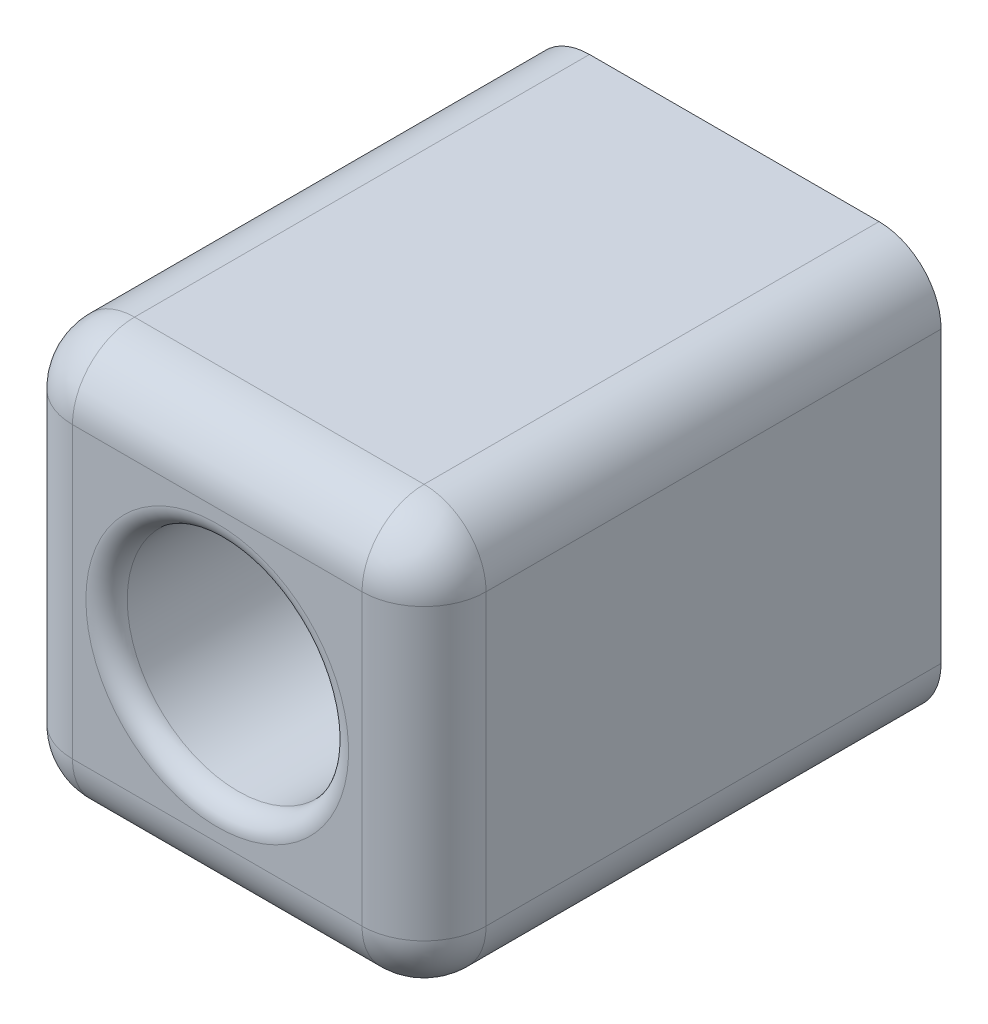
from build123d import *

# Parameters (mm, degrees)
SKETCH1_R           = 3.2
BOSS_EXTRUDE1_DEPTH = 25
FILLET1_R           = 3
SKETCH2_R           = 5.35
CUT_EXTRUDE1_DEPTH  = 19.5
FILLET2_R           = 1
FILLET3_R           = 1


with BuildPart() as part:
    # Sketch1 → Boss-Extrude1 (new body)
    with BuildSketch(Plane.XY):
        with BuildLine():
            Line((-7, -10), (7, -10))
            ThreePointArc((7, -10), (9.121320344, -9.121320344), (10, -7))
            Line((10, -7), (10, 7))
            ThreePointArc((10, 7), (9.121320344, 9.121320344), (7, 10))
            Line((7, 10), (-7, 10))
            ThreePointArc((-7, 10), (-9.121320344, 9.121320344), (-10, 7))
            Line((-10, 7), (-10, -7))
            ThreePointArc((-10, -7), (-9.121320344, -9.121320344), (-7, -10))
        make_face()
        Circle(SKETCH1_R, mode=Mode.SUBTRACT)
    extrude(amount=BOSS_EXTRUDE1_DEPTH)

    # Fillet1
    fillet1_edges = [part.edges().sort_by_distance(p)[0] for p in [
        (9.121320344, 9.121320344, 25),
        (0, 10, 25),
        (-9.121320344, 9.121320344, 25),
        (-10, 0, 25),
        (-9.121320344, -9.121320344, 25),
        (0, -10, 25),
        (9.121320344, -9.121320344, 25),
        (10, 0, 25),
    ]]
    fillet(fillet1_edges, radius=FILLET1_R)

    # Sketch2 → Cut-Extrude1 (cut)
    with BuildSketch(Plane.XY.offset(25)):
        Circle(SKETCH2_R)
    extrude(amount=-CUT_EXTRUDE1_DEPTH, mode=Mode.SUBTRACT)

    # Fillet2
    fillet2_edges = [part.edges().sort_by_distance(p)[0] for p in [
        (-5.35, 0, 25),
    ]]
    fillet(fillet2_edges, radius=FILLET2_R)

    # Fillet3
    fillet3_edges = [part.edges().sort_by_distance(p)[0] for p in [
        (-5.35, 0, 5.5),
    ]]
    fillet(fillet3_edges, radius=FILLET3_R)


solid = part.part
